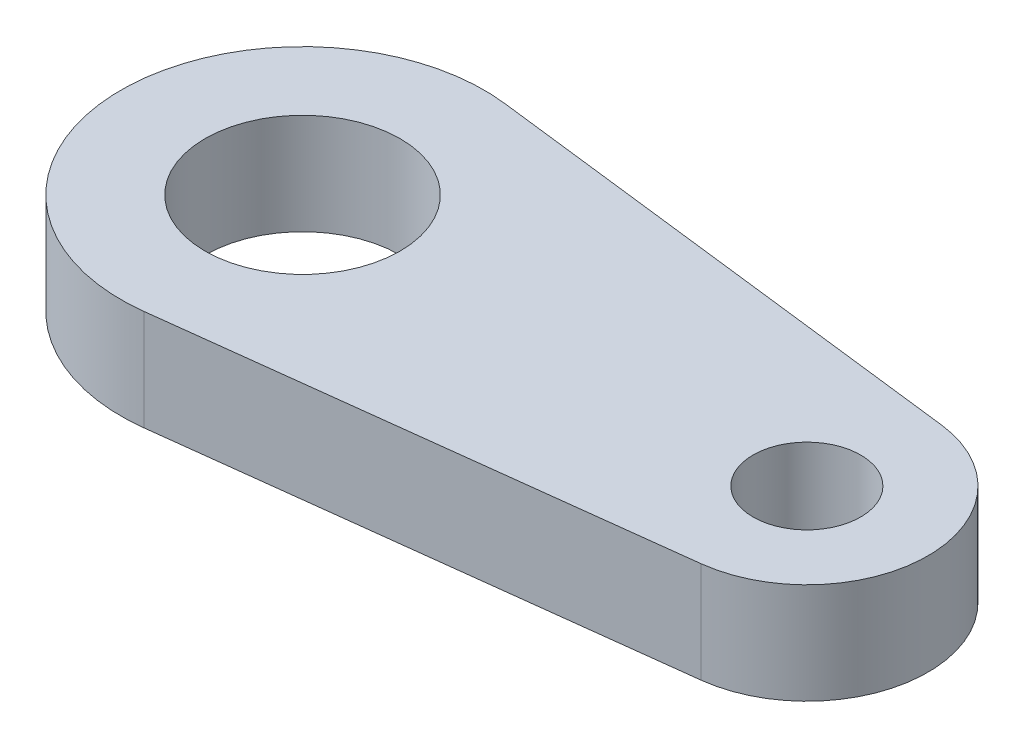
from build123d import *

# Parameters (mm, degrees)
BOSS_EXTRUDE1_DEPTH = 3
SKETCH2_R           = 2.9
SKETCH2_R_2         = 1.6
CUT_EXTRUDE1_DEPTH  = 20.598979565


with BuildPart() as part:
    # Sketch1 → Boss-Extrude1 (new body)
    with BuildSketch(Plane(origin=(0, 0, 0), x_dir=(1, 0, 0), z_dir=(0, 1, 0))):
        with BuildLine():
            Line((0.648, 5.360979015), (15.432, 3.57398601))
            ThreePointArc((15.432, 3.57398601), (18.6, 0), (15.432, -3.57398601))
            Line((15.432, -3.57398601), (0.648, -5.360979015))
            ThreePointArc((0.648, -5.360979015), (-5.4, 0), (0.648, 5.360979015))
        make_face()
    extrude(amount=BOSS_EXTRUDE1_DEPTH)

    # Sketch2 → Cut-Extrude1 (cut, through all)
    with BuildSketch(Plane(origin=(0, 3, 0), x_dir=(1, 0, 0), z_dir=(0, 1, 0))):
        with Locations(Location((0, 0, 0), (0, 0, 270))):
            Circle(SKETCH2_R)
        with Locations(Location((15, 0, 0), (0, 0, 270))):
            Circle(SKETCH2_R_2)
    extrude(amount=-CUT_EXTRUDE1_DEPTH, mode=Mode.SUBTRACT)


solid = part.part
